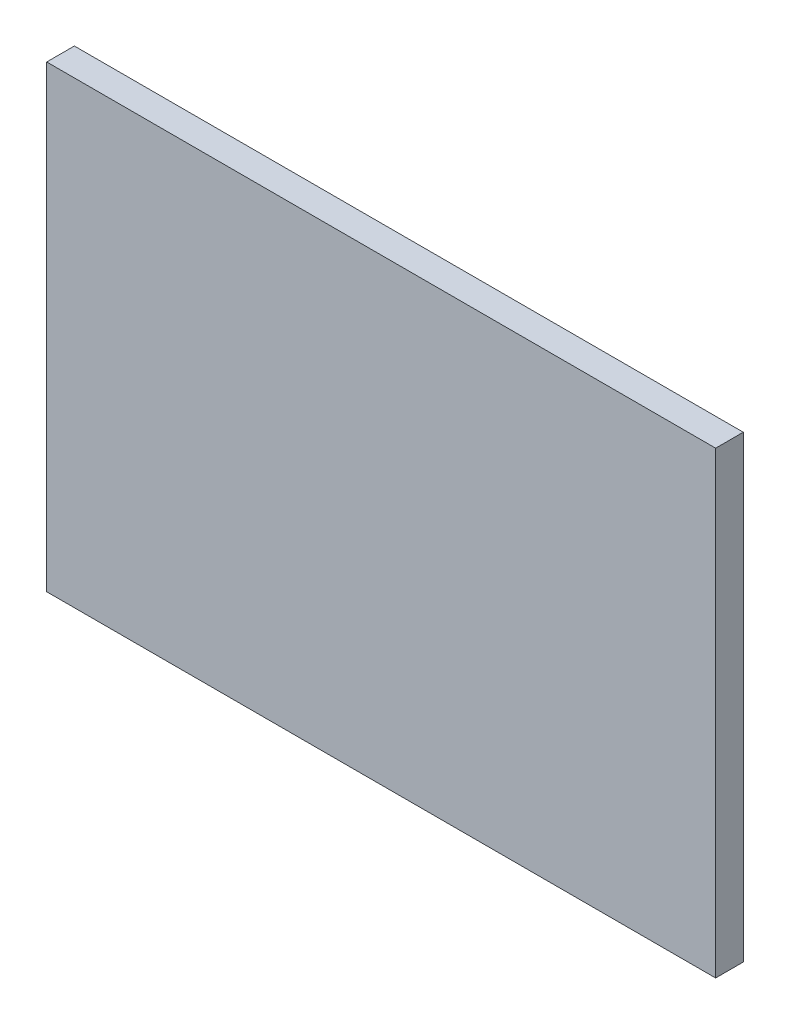
from build123d import *

# Parameters (mm, degrees)
SKETCH1_W           = 121
SKETCH1_H           = 83
BOSS_EXTRUDE1_DEPTH = 5


with BuildPart() as part:
    # Sketch1 → Boss-Extrude1 (new body)
    with BuildSketch(Plane.XY):
        with Locations((14.701535509, -7.06621881)):
            Rectangle(SKETCH1_W, SKETCH1_H)
    extrude(amount=BOSS_EXTRUDE1_DEPTH)


solid = part.part
